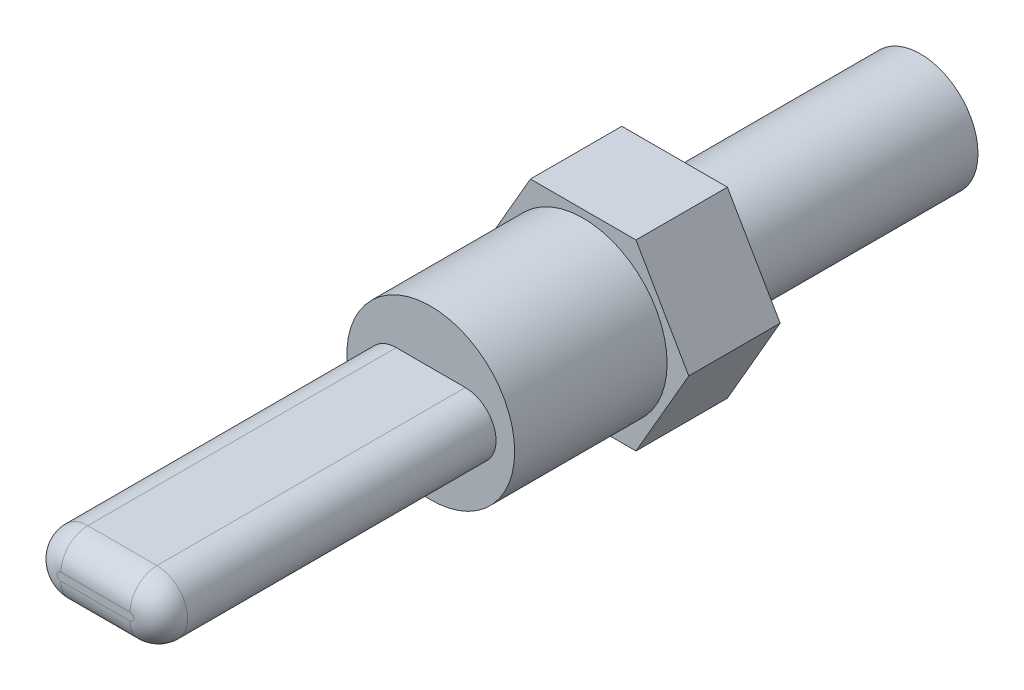
from build123d import *

# Parameters (mm, degrees)
SKETCH1_R           = 1.5
BOSS_EXTRUDE1_DEPTH = 6.4
BOSS_EXTRUDE2_DEPTH = 2.38
SKETCH3_R           = 2.185
BOSS_EXTRUDE3_DEPTH = 3.97
BOSS_EXTRUDE4_DEPTH = 8.73
FILLET1_R           = 0.7


with BuildPart() as part:
    # Sketch1 → Boss-Extrude1 (new body)
    with BuildSketch(Plane.XY):
        Circle(SKETCH1_R)
    extrude(amount=BOSS_EXTRUDE1_DEPTH)

    # Sketch2 → Boss-Extrude2 (add)
    with BuildSketch(Plane.XY.offset(6.4)):
        Polygon((1.374093641, -2.38), (2.748187281, 0), (1.374093641, 2.38), (-1.374093641, 2.38), (-2.748187281, 0), (-1.374093641, -2.38), align=None)
    extrude(amount=BOSS_EXTRUDE2_DEPTH)

    # Sketch3 → Boss-Extrude3 (add)
    with BuildSketch(Plane.XY.offset(8.78)):
        Circle(SKETCH3_R)
    extrude(amount=BOSS_EXTRUDE3_DEPTH)

    # Sketch4 → Boss-Extrude4 (add)
    with BuildSketch(Plane.XY.offset(12.75)):
        with BuildLine():
            Line((-0.9, 0.8), (0.9, 0.8))
            ThreePointArc((0.9, 0.8), (1.7, 0), (0.9, -0.8))
            Line((0.9, -0.8), (-0.9, -0.8))
            ThreePointArc((-0.9, -0.8), (-1.7, 0), (-0.9, 0.8))
        make_face()
    extrude(amount=BOSS_EXTRUDE4_DEPTH)

    # Fillet1
    fillet1_edges = [part.edges().sort_by_distance(p)[0] for p in [
        (-1.7, 0, 21.48),
        (0, -0.8, 21.48),
        (1.7, 0, 21.48),
        (0, 0.8, 21.48),
    ]]
    fillet(fillet1_edges, radius=FILLET1_R)


solid = part.part
